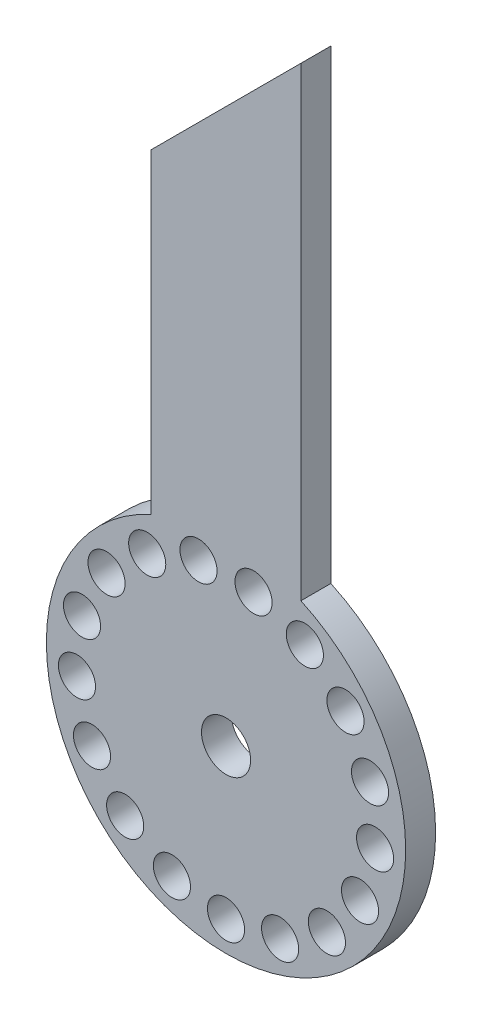
from build123d import *

# Parameters (mm, degrees)
EXTRUDE_3_DEPTH     = 5
SKETCH_12_W         = 25
SKETCH_12_H         = 25
CUT_EXTRUDE_2_DEPTH = 5
CUT_EXTRUDE_3_DEPTH = 5
SKETCH_14_R         = 4.1
CUT_EXTRUDE_4_DEPTH = 5
SKETCH_16_R         = 3.1
CUT_EXTRUDE_5_DEPTH = 5
CUT_EXTRUDE_6_DEPTH = 5
SKETCH_18_W         = 25
SKETCH_18_H         = 35
EXTRUDE_4_DEPTH     = 5
CUT_EXTRUDE_7_DEPTH = 5


with BuildPart() as part:
    # 草图8 → 凸台-拉伸3 (new body)
    with BuildSketch(Plane.XY):
        with BuildLine():
            Line((-12.5, 150), (12.5, 150))
            Line((12.5, 150), (12.5, 27.271780287))
            ThreePointArc((12.5, 27.271780287), (0, -30), (-12.5, 27.271780287))
            Line((-12.5, 27.271780287), (-12.5, 150))
        make_face()
    extrude(amount=EXTRUDE_3_DEPTH)

    # 草图12 → 切除-拉伸2 (cut)
    with BuildSketch(Plane.XY.offset(5)):
        with Locations((0, 137.5)):
            Rectangle(SKETCH_12_W, SKETCH_12_H)
    extrude(amount=-CUT_EXTRUDE_2_DEPTH, mode=Mode.SUBTRACT)

    # 草图13 → 切除-拉伸3 (cut)
    with BuildSketch(Plane.XY.offset(5)):
        Polygon((-12.5, 125), (12.5, 125), (-12.5, 100), align=None)
    extrude(amount=-CUT_EXTRUDE_3_DEPTH, mode=Mode.SUBTRACT)

    # 草图14 → 切除-拉伸4 (cut)
    with BuildSketch(Plane.XY.offset(5)):
        Circle(SKETCH_14_R)
    extrude(amount=-CUT_EXTRUDE_4_DEPTH, mode=Mode.SUBTRACT)

    # 草图16 → 切除-拉伸5 (cut)
    with BuildSketch(Plane.XY.offset(5)):
        with Locations((0, -25)):
            Circle(SKETCH_16_R)
        with Locations((-9.031041655, -23.311805735)):
            Circle(SKETCH_16_R)
        with Locations((-16.842391091, -18.475222931)):
            Circle(SKETCH_16_R)
        with Locations((-22.379082284, -11.143458894)):
            Circle(SKETCH_16_R)
        with Locations((-24.893354407, -2.306708987)):
            Circle(SKETCH_16_R)
        with Locations((-24.045641079, 6.841574752)):
            Circle(SKETCH_16_R)
        with Locations((-19.950430682, 15.065865909)):
            Circle(SKETCH_16_R)
        with Locations((-13.160804072, 21.255428393)):
            Circle(SKETCH_16_R)
        with Locations((-4.593737945, 24.574327492)):
            Circle(SKETCH_16_R)
        with Locations((4.593737945, 24.574327492)):
            Circle(SKETCH_16_R)
        with Locations((13.160804072, 21.255428393)):
            Circle(SKETCH_16_R)
        with Locations((19.950430682, 15.065865909)):
            Circle(SKETCH_16_R)
        with Locations((24.045641079, 6.841574752)):
            Circle(SKETCH_16_R)
        with Locations((24.893354407, -2.306708987)):
            Circle(SKETCH_16_R)
        with Locations((22.379082284, -11.143458894)):
            Circle(SKETCH_16_R)
        with Locations((16.842391091, -18.475222931)):
            Circle(SKETCH_16_R)
        with Locations((9.031041655, -23.311805735)):
            Circle(SKETCH_16_R)
    extrude(amount=-CUT_EXTRUDE_5_DEPTH, mode=Mode.SUBTRACT)

    # 草图17 → 切除-拉伸6 (cut)
    with BuildSketch(Plane.XY.offset(5)):
        Polygon((-12.5, 100), (12.5, 125), (12.5, 95), (-12.5, 70), align=None)
    extrude(amount=-CUT_EXTRUDE_6_DEPTH, mode=Mode.SUBTRACT)

    # 草图18 → 凸台-拉伸4 (add)
    with BuildSketch(Plane.XY.offset(5)):
        with Locations((0, 87.5)):
            Rectangle(SKETCH_18_W, SKETCH_18_H)
    extrude(amount=-EXTRUDE_4_DEPTH)

    # 草图19 → 切除-拉伸7 (cut)
    with BuildSketch(Plane.XY.offset(5)):
        Polygon((-12.5, 105), (12.5, 105), (-12.5, 80), align=None)
    extrude(amount=-CUT_EXTRUDE_7_DEPTH, mode=Mode.SUBTRACT)


solid = part.part
